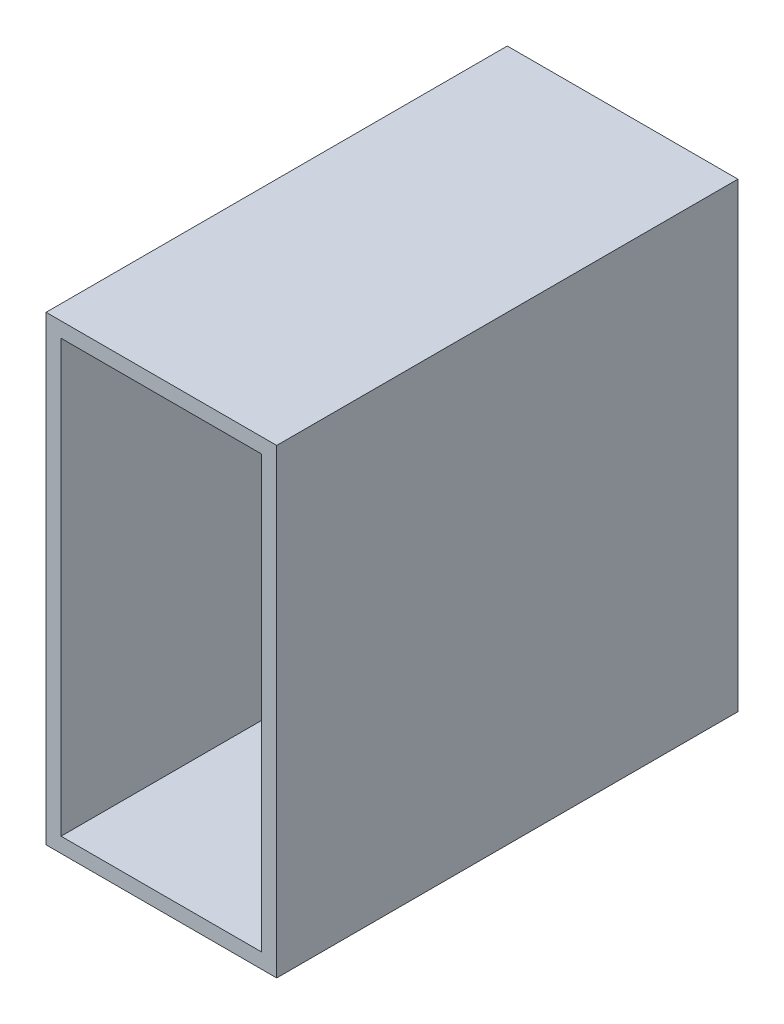
from build123d import *

# Parameters (mm, degrees)
SKETCH1_W           = 25.4
SKETCH1_H           = 50.8
BOSS_EXTRUDE1_DEPTH = 50.8
SKETCH2_W           = 22.098
SKETCH2_H           = 47.498
CUT_EXTRUDE1_DEPTH  = 77.412094128


with BuildPart() as part:
    # Sketch1 → Boss-Extrude1 (new body)
    with BuildSketch(Plane.XY):
        with Locations((-35.737209302, -4.799418605)):
            Rectangle(SKETCH1_W, SKETCH1_H)
    extrude(amount=BOSS_EXTRUDE1_DEPTH)

    # Sketch2 → Cut-Extrude1 (cut, through all)
    with BuildSketch(Plane.XY.offset(50.8)):
        with Locations((-35.737209302, -4.799418605)):
            Rectangle(SKETCH2_W, SKETCH2_H)
    extrude(amount=-CUT_EXTRUDE1_DEPTH, mode=Mode.SUBTRACT)


solid = part.part
